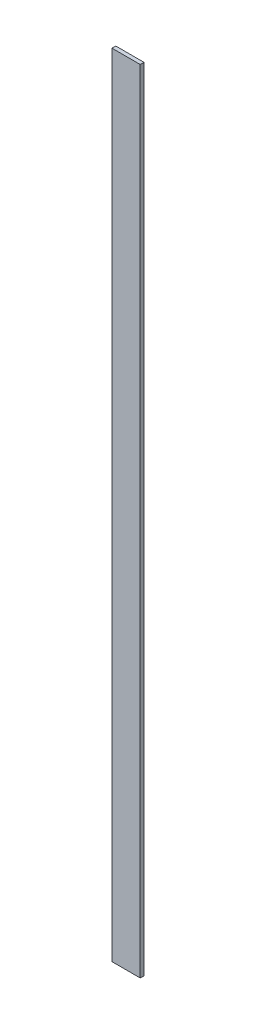
from build123d import *

# Parameters (mm, degrees)
ESQUISSE1_W        = 30
ESQUISSE1_H        = 840
BOSS_EXTRU_1_DEPTH = 4


with BuildPart() as part:
    # Esquisse1 → Boss.-Extru.1 (new body)
    with BuildSketch(Plane.XY):
        with Locations((-1429.551179469, 2057.100085921)):
            Rectangle(ESQUISSE1_W, ESQUISSE1_H)
    extrude(amount=BOSS_EXTRU_1_DEPTH)


solid = part.part
